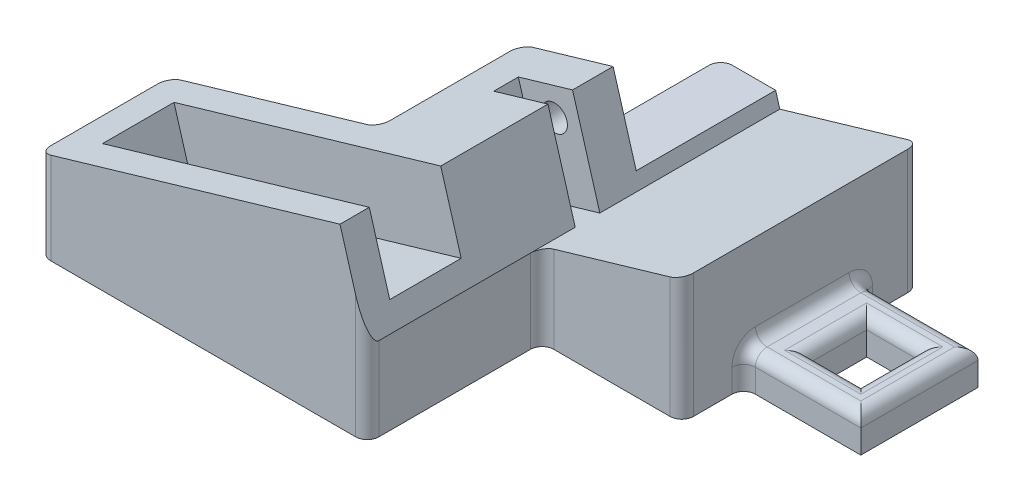
from build123d import *

# Parameters (mm, degrees)
SKETCH2_W                       = 43.976301399
SKETCH2_H                       = 37.406376753
BOSS_EXTRUDE1_DEPTH             = 3
BOSS_EXTRUDE2_REACH             = 40.151
BOSS_EXTRUDE2_DIRECTION_2_REACH = 40.151
SKETCH4_W                       = 23.72463769
SKETCH4_H                       = 6.1
CUT_EXTRUDE1_DEPTH              = 6.2
SKETCH5_W                       = 13.436339427
SKETCH5_H                       = 17.119562917
CUT_EXTRUDE2_DEPTH              = 42.11242086
CUT_EXTRUDE3_DEPTH              = 40.896849069
CUT_EXTRUDE3_DEPTH_BACK         = 40.896849069
SKETCH6_W                       = 32.063710036
SKETCH6_H                       = 2.195719192
SKETCH7_W                       = 17.859472784
SKETCH7_H                       = 24.110657561
CUT_EXTRUDE4_DEPTH              = 39.572188243
SKETCH9_W                       = 5.100000004
SKETCH9_H                       = 2.100000005
CUT_EXTRUDE5_DEPTH              = 8.272220174
SKETCH10_W                      = 4.059731886
SKETCH10_H                      = 35.210657561
CUT_EXTRUDE6_DEPTH              = 39.572188243
CUT_EXTRUDE7_DEPTH              = 11.9
SKETCH14_W                      = 10
SKETCH14_H                      = 3
BOSS_EXTRUDE3_DEPTH             = 10
SKETCH15_W                      = 4.5
SKETCH15_H                      = 5
CUT_EXTRUDE8_DEPTH              = 47.530169979
FILLET1_R                       = 1
CUT_EXTRUDE9_DEPTH              = 49.140668642
CUT_EXTRUDE10_DEPTH             = 11.9
SKETCH19_R                      = 1.1
CUT_EXTRUDE11_DEPTH             = 47.161274086
BOSS_EXTRUDE4_DEPTH             = 11.9
FILLET2_R                       = 1
SKETCH22_W                      = 10
SKETCH22_H                      = 3
BOSS_EXTRUDE5_DEPTH             = 10
SKETCH23_W                      = 6.079403202
SKETCH23_H                      = 5
CUT_EXTRUDE12_DEPTH             = 47.530169979
FILLET4_R                       = 1


with BuildPart() as part:
    # Sketch2 → Boss-Extrude1 (new body)
    with BuildSketch(Plane(origin=(0, 0, 0), x_dir=(1, 0, 0), z_dir=(0, 1, 0))):
        with Locations((6.873999922, -6.064560357)):
            Rectangle(SKETCH2_W, SKETCH2_H)
    extrude(amount=BOSS_EXTRUDE1_DEPTH)

    # Boss-Extrude2: up to this face of the body (flat: up to its plane)
    boss_extrude2_end = Plane(part.part.faces().sort_by_distance((6.873999922, 1.5, 24.767748733))[0])
    # Sketch3 → Boss-Extrude2 (add, up to the picked face)
    with BuildSketch(Plane.XY, mode=Mode.PRIVATE) as boss_extrude2_sk1:
        Polygon((3.322651848, 11.739980321), (-2.884556794, 9.919492418), (-11.054418892, 7.523385572), (-11.054418892, 3), (28.862150621, 3), (28.862150621, 10.609703324), (16.949559258, 7.115906075), (14.621493291, 15.05377326), align=None)
    boss_extrude2_tool1 = split(extrude(boss_extrude2_sk1.sketch, amount=BOSS_EXTRUDE2_REACH, mode=Mode.PRIVATE), bisect_by=boss_extrude2_end, keep=Keep.BOTH, mode=Mode.PRIVATE)
    add(boss_extrude2_tool1.solids().sort_by(Axis((9.048322, 7.098551, 0), (0, 0, 1)))[0])

    # Boss-Extrude2 direction 2: up to this face of the body (flat: up to its plane)
    boss_extrude2_direction_2_end = Plane(part.part.faces().sort_by_distance((6.873999922, 1.5, -12.63862802))[0])
    # Sketch3 → Boss-Extrude2 direction 2 (add, up to the picked face)
    with BuildSketch(Plane.XY, mode=Mode.PRIVATE) as boss_extrude2_direction_2_sk1:
        Polygon((3.322651848, 11.739980321), (-2.884556794, 9.919492418), (-11.054418892, 7.523385572), (-11.054418892, 3), (28.862150621, 3), (28.862150621, 10.609703324), (16.949559258, 7.115906075), (14.621493291, 15.05377326), align=None)
    boss_extrude2_direction_2_tool1 = split(extrude(boss_extrude2_direction_2_sk1.sketch, amount=-BOSS_EXTRUDE2_DIRECTION_2_REACH, mode=Mode.PRIVATE), bisect_by=boss_extrude2_direction_2_end, keep=Keep.BOTH, mode=Mode.PRIVATE)
    add(boss_extrude2_direction_2_tool1.solids().sort_by(Axis((9.048322, 7.098551, 0), (0, 0, -1)))[0])

    # Sketch4 → Cut-Extrude1 (cut)
    with BuildSketch(Plane(origin=(-2.907293344, 9.912824104, 0), x_dir=(0.9595812271500734, 0.2814318185656328, 0), z_dir=(-0.2814318185656328, 0.9595812271500734, 0))):
        with Locations((6.404802415, -17.022029541)):
            Rectangle(SKETCH4_W, SKETCH4_H)
    extrude(amount=-CUT_EXTRUDE1_DEPTH, mode=Mode.SUBTRACT)

    # Sketch5 → Cut-Extrude2 (cut, through all)
    with BuildSketch(Plane(origin=(-0.295587327, 0, 0), x_dir=(1, 0, 0), z_dir=(0, 1, 0))):
        with Locations((23.963316299, -16.207967274)):
            Rectangle(SKETCH5_W, SKETCH5_H)
    extrude(amount=CUT_EXTRUDE2_DEPTH, mode=Mode.SUBTRACT)

    # Sketch6 → Cut-Extrude3 (cut, two sides: drawn at the far end of the back side and taken through both)
    with BuildSketch(Plane(origin=(0, 3, 0), x_dir=(1, 0, 0), z_dir=(0, 1, 0)).offset(-CUT_EXTRUDE3_DEPTH_BACK)):
        with Locations((0.91770424, -23.669889137)):
            Rectangle(SKETCH6_W, SKETCH6_H)
    extrude(amount=CUT_EXTRUDE3_DEPTH + CUT_EXTRUDE3_DEPTH_BACK, mode=Mode.SUBTRACT)

    # Sketch7 → Cut-Extrude4 (cut, through all)
    with BuildSketch(Plane(origin=(0, 3, 0), x_dir=(1, 0, 0), z_dir=(0, 1, 0))):
        with Locations((-2.1246825, 0.583299239)):
            Rectangle(SKETCH7_W, SKETCH7_H)
    extrude(amount=CUT_EXTRUDE4_DEPTH, mode=Mode.SUBTRACT)

    # Sketch9 → Cut-Extrude5 (cut)
    with BuildSketch(Plane(origin=(-2.907293344, 9.912824104, 0), x_dir=(0.9595812271500733, 0.28143181856563293, 0), z_dir=(-0.28143181856563293, 0.9595812271500733, 0))):
        with Locations((15.995967709, -3.773090404)):
            Rectangle(SKETCH9_W, SKETCH9_H)
    extrude(amount=-CUT_EXTRUDE5_DEPTH, mode=Mode.SUBTRACT)

    # Sketch10 → Cut-Extrude6 (cut, through all)
    with BuildSketch(Plane(origin=(0, 3, 0), x_dir=(1, 0, 0), z_dir=(0, 1, 0))):
        with Locations((-13.084284835, -4.966700761)):
            Rectangle(SKETCH10_W, SKETCH10_H)
    extrude(amount=-CUT_EXTRUDE6_DEPTH, mode=Mode.SUBTRACT)

    # Sketch11 → Cut-Extrude7 (cut)
    with BuildSketch(Plane(origin=(0, 0, -12.63862802), x_dir=(-1, 0, 0), z_dir=(0, 0, -1))):
        Polygon((-6.805053892, 3), (-11.906625133, 3), (-11.906625133, 14.257540215), (-6.805053892, 12.761320373), align=None)
    extrude(amount=-CUT_EXTRUDE7_DEPTH, mode=Mode.SUBTRACT)

    # Sketch14 → Boss-Extrude3 (add)
    with BuildSketch(Plane(origin=(28.862150621, 0, 0), x_dir=(0, 0, -1), z_dir=(1, 0, 0))):
        with Locations((2.63862802, 1.5)):
            Rectangle(SKETCH14_W, SKETCH14_H)
    extrude(amount=BOSS_EXTRUDE3_DEPTH)

    # Sketch15 → Cut-Extrude8 (cut, through all)
    with BuildSketch(Plane(origin=(0, 3, 0), x_dir=(1, 0, 0), z_dir=(0, 1, 0))):
        with Locations((34.112150621, 2.63862802)):
            Rectangle(SKETCH15_W, SKETCH15_H)
    extrude(amount=-CUT_EXTRUDE8_DEPTH, mode=Mode.SUBTRACT)

    # Fillet1
    fillet1_edges = [part.edges().sort_by_distance(p)[0] for p in [
        (28.862150621, 1.5, -7.63862802),
        (28.862150621, 1.5, 2.36137198),
        (33.862150621, 3, -7.63862802),
        (38.862150621, 3, -2.63862802),
        (33.862150621, 3, 2.36137198),
        (28.862150621, 3, -2.63862802),
        (36.362150621, 3, -2.63862802),
        (34.112150621, 3, -5.13862802),
        (31.862150621, 3, -2.63862802),
        (34.112150621, 3, -0.13862802),
    ]]
    fillet(fillet1_edges, radius=FILLET1_R)

    # Sketch17 → Cut-Extrude9 (cut, through all)
    with BuildSketch(Plane(origin=(-1.914484966, 3, 0), x_dir=(1, 0, 0), z_dir=(0, 1, 0))):
        Polygon((13.8211101, 12.63862802), (13.8211101, 0.73862802), (8.719538859, 0.73862802), (8.719538859, -11.472029541), (-9.139933926, -11.472029541), (-9.139933926, 12.63862802), align=None)
    extrude(amount=-CUT_EXTRUDE9_DEPTH, mode=Mode.SUBTRACT)

    # Sketch18 → Cut-Extrude10 (cut)
    with BuildSketch(Plane(origin=(0, 0, -12.63862802), x_dir=(-1, 0, 0), z_dir=(0, 0, -1))):
        Polygon((-16.949559258, 7.115906075), (-11.906625133, 5.636883683), (-11.906625133, 14.257540215), (-14.621493291, 15.05377326), align=None)
    extrude(amount=-CUT_EXTRUDE10_DEPTH, mode=Mode.SUBTRACT)

    # Sketch19 → Cut-Extrude11 (cut, through all)
    with BuildSketch(Plane.XY.offset(2.723090401)):
        with Locations((13.083993021, 12.226100253)):
            Circle(SKETCH19_R)
    extrude(amount=-CUT_EXTRUDE11_DEPTH, mode=Mode.SUBTRACT)

    # Sketch21 → Boss-Extrude4 (add)
    with BuildSketch(Plane(origin=(0, 0, -0.73862802), x_dir=(-1, 0, 0), z_dir=(0, 0, -1))):
        Polygon((-16.949559258, 7.115906075), (-11.906625133, 5.636883683), (-11.906625133, 8.331943724), (-16.592912341, 8.331943724), align=None)
    extrude(amount=BOSS_EXTRUDE4_DEPTH)

    # Fillet2
    fillet2_edges = [part.edges().sort_by_distance(p)[0] for p in [
        (16.949559258, 3.557953038, 7.648185816),
        (16.949559258, 3.557953038, 22.572029541),
        (28.862150621, 5.304851662, 7.648185816),
        (28.862150621, 5.304851662, -12.63862802),
        (11.906625133, 4.165971862, -0.73862802),
        (11.906625133, 4.165971862, -12.63862802),
        (-11.054418892, 3.761692786, 11.472029541),
        (-11.054418892, 3.761692786, 22.572029541),
        (6.805053892, 6.380660187, -0.73862802),
        (6.805053892, 6.380660187, 11.472029541),
    ]]
    fillet(fillet2_edges, radius=FILLET2_R)

    # Sketch22 → Boss-Extrude5 (add)
    with BuildSketch(Plane(origin=(0, 0, 11.472029541), x_dir=(-1, 0, 0), z_dir=(0, 0, -1))):
        with Locations((-1.805053892, 1.5)):
            Rectangle(SKETCH22_W, SKETCH22_H)
    extrude(amount=BOSS_EXTRUDE5_DEPTH)

    # Sketch23 → Cut-Extrude12 (cut, through all)
    with BuildSketch(Plane(origin=(0, 3, 0), x_dir=(1, 0, 0), z_dir=(0, 1, 0))):
        with Locations((2.344755493, -6.472029541)):
            Rectangle(SKETCH23_W, SKETCH23_H)
    extrude(amount=-CUT_EXTRUDE12_DEPTH, mode=Mode.SUBTRACT)

    # Fillet4
    fillet4_edges = [part.edges().sort_by_distance(p)[0] for p in [
        (-3.194946108, 3, 6.472029541),
        (-3.194946108, 1.5, 1.472029541),
        (1.805053892, 3, 1.472029541),
        (5.384457094, 3, 6.472029541),
        (2.344755493, 3, 3.972029541),
        (-0.694946108, 3, 6.472029541),
        (2.344755493, 3, 8.972029541),
    ]]
    fillet(fillet4_edges, radius=FILLET4_R)


solid = part.part
